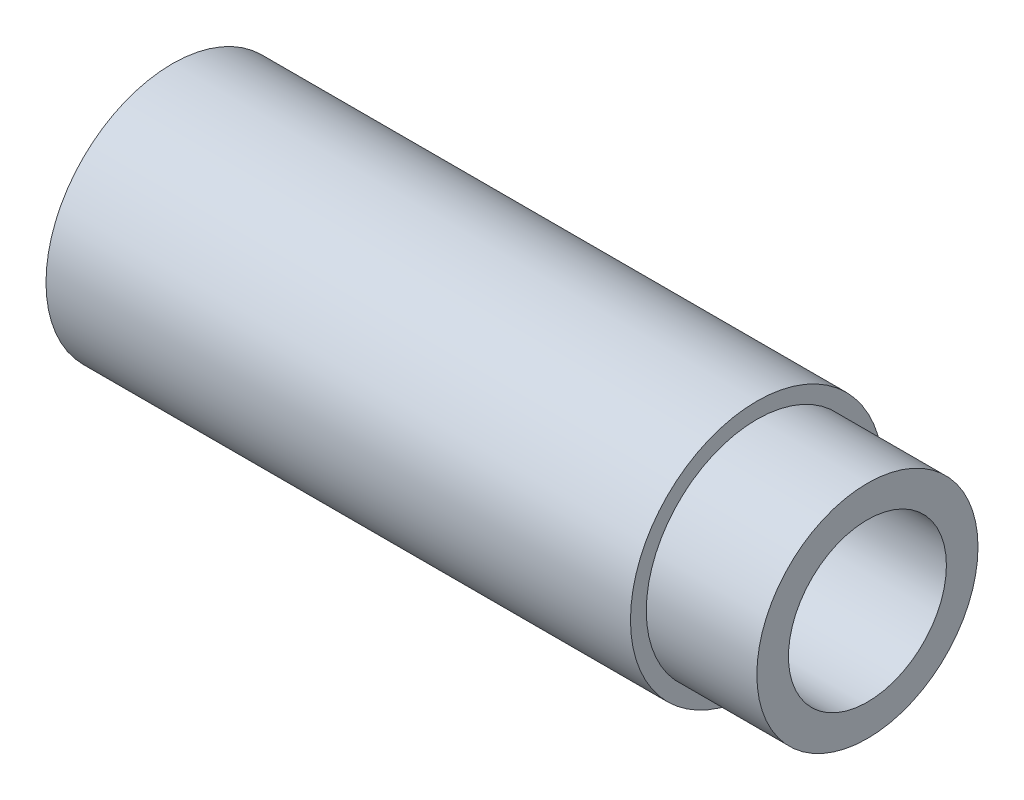
from build123d import *


with BuildPart() as part:
    # Sketch2 → Revolve1 (revolve)
    with BuildSketch(Plane.XY, mode=Mode.PRIVATE) as revolve1_sk:
        Polygon((0, 3.5), (-3.5, 3.5), (-3.5, 4), (-22, 4), (-22, 2.5), (0, 2.5), align=None)
    revolve(revolve1_sk.sketch.rotate(Axis((0, 0, 0), (-1, 0, 0)), 90), axis=Axis((0, 0, 0), (-1, 0, 0)))


solid = part.part
